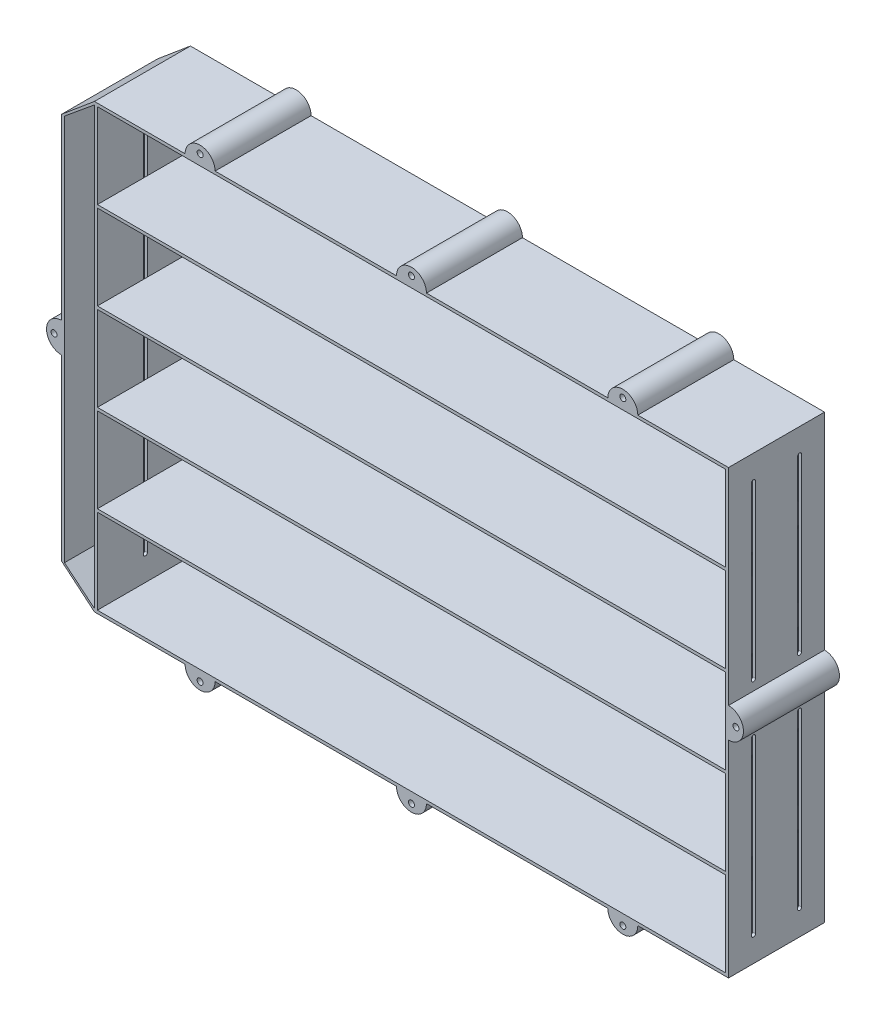
from build123d import *

# Parameters (mm, degrees)
SKETCH1_R           = 3
BOSS_EXTRUDE1_DEPTH = 96.2
SKETCH2_W           = 629.4
SKETCH2_H           = 85
CUT_EXTRUDE1_DEPTH  = 93.2
LPATTERN1_COUNT     = 5
LPATTERN1_PITCH     = 88
CUT_EXTRUDE3_DEPTH  = 93.2
CUT_EXTRUDE4_DEPTH  = 3
CUT_EXTRUDE5_DEPTH  = 3
CUT_EXTRUDE6_DEPTH  = 3


with BuildPart() as part:
    # Sketch1 → Boss-Extrude1 (new body)
    with BuildSketch(Plane.XY):
        with BuildLine():
            Line((0, 0), (0, 206.5))
            ThreePointArc((0, 206.5), (15, 221.5), (0, 236.5))
            Line((0, 236.5), (0, 443))
            Line((0, 443), (-90.9, 443))
            ThreePointArc((-90.9, 443), (-105.9, 458), (-120.9, 443))
            Line((-120.9, 443), (-302.7, 443))
            ThreePointArc((-302.7, 443), (-317.7, 458), (-332.7, 443))
            Line((-332.7, 443), (-514.5, 443))
            ThreePointArc((-514.5, 443), (-529.5, 458), (-544.5, 443))
            Line((-544.5, 443), (-635.4, 443))
            Line((-635.4, 443), (-668.4, 415.309712171))
            Line((-668.4, 415.309712171), (-668.4, 236.5))
            ThreePointArc((-668.4, 236.5), (-683.4, 221.5), (-668.4, 206.5))
            Line((-668.4, 206.5), (-668.4, 27.690287829))
            Line((-668.4, 27.690287829), (-635.4, 0))
            Line((-635.4, 0), (-544.5, 0))
            ThreePointArc((-544.5, 0), (-529.5, -15), (-514.5, 0))
            Line((-514.5, 0), (-332.7, 0))
            ThreePointArc((-332.7, 0), (-317.7, -15), (-302.7, 0))
            Line((-302.7, 0), (-120.9, 0))
            ThreePointArc((-120.9, 0), (-105.9, -15), (-90.9, 0))
            Line((-90.9, 0), (0, 0))
        make_face()
        with Locations(Location((-529.5, 450.5, 0), (0, 0, 180))):
            Circle(SKETCH1_R, mode=Mode.SUBTRACT)
        with Locations(Location((-317.7, 450.5, 0), (0, 0, 180))):
            Circle(SKETCH1_R, mode=Mode.SUBTRACT)
        with Locations(Location((-105.9, 450.5, 0), (0, 0, 180))):
            Circle(SKETCH1_R, mode=Mode.SUBTRACT)
        with Locations(Location((7.5, 221.5, 0), (0, 0, 180))):
            Circle(SKETCH1_R, mode=Mode.SUBTRACT)
        with Locations(Location((-675.9, 221.5, 0), (0, 0, 180))):
            Circle(SKETCH1_R, mode=Mode.SUBTRACT)
        with Locations(Location((-529.5, -7.5, 0), (0, 0, 180))):
            Circle(SKETCH1_R, mode=Mode.SUBTRACT)
        with Locations(Location((-317.7, -7.5, 0), (0, 0, 180))):
            Circle(SKETCH1_R, mode=Mode.SUBTRACT)
        with Locations(Location((-105.9, -7.5, 0), (0, 0, 180))):
            Circle(SKETCH1_R, mode=Mode.SUBTRACT)
    extrude(amount=BOSS_EXTRUDE1_DEPTH)

    # Sketch2 → Cut-Extrude1 (cut)
    with BuildSketch(Plane.XY.offset(96.2)):
        with Locations((-317.7, 397.5)):
            Rectangle(SKETCH2_W, SKETCH2_H)
    cut_extrude1 = extrude(amount=-CUT_EXTRUDE1_DEPTH, mode=Mode.SUBTRACT)

    # LPattern1: Cut-Extrude1 ×5
    with Locations(*[(0, -i * LPATTERN1_PITCH, 0) for i in range(1, LPATTERN1_COUNT)]):
        add(cut_extrude1, mode=Mode.SUBTRACT)

    # Sketch5 → Cut-Extrude3 (cut)
    with BuildSketch(Plane.XY.offset(96.2)):
        Polygon((-665.4, 415.309712171), (-665.4, 27.690287829), (-635.4, 3), (-635.4, 440), align=None)
    extrude(amount=-CUT_EXTRUDE3_DEPTH, mode=Mode.SUBTRACT)

    # Sketch7 → Cut-Extrude4 (cut)
    with BuildSketch(Plane(origin=(0, 0, 0), x_dir=(0, 0, -1), z_dir=(1, 0, 0))):
        with BuildLine():
            Line((-69.2, 418), (-69.2, 246.5))
            ThreePointArc((-69.2, 246.5), (-71.2, 244.5), (-73.2, 246.5))
            Line((-73.2, 246.5), (-73.2, 418))
            ThreePointArc((-73.2, 418), (-71.2, 420), (-69.2, 418))
        make_face()
        with BuildLine():
            Line((-23, 418), (-23, 246.5))
            ThreePointArc((-23, 246.5), (-25, 244.5), (-27, 246.5))
            Line((-27, 246.5), (-27, 418))
            ThreePointArc((-27, 418), (-25, 420), (-23, 418))
        make_face()
        with BuildLine():
            Line((-69.2, 196.5), (-69.2, 25))
            ThreePointArc((-69.2, 25), (-71.2, 23), (-73.2, 25))
            Line((-73.2, 25), (-73.2, 196.5))
            ThreePointArc((-73.2, 196.5), (-71.2, 198.5), (-69.2, 196.5))
        make_face()
        with BuildLine():
            Line((-23, 196.5), (-23, 25))
            ThreePointArc((-23, 25), (-25, 23), (-27, 25))
            Line((-27, 25), (-27, 196.5))
            ThreePointArc((-27, 196.5), (-25, 198.5), (-23, 196.5))
        make_face()
    extrude(amount=-CUT_EXTRUDE4_DEPTH, mode=Mode.SUBTRACT)

    # Sketch8 → Cut-Extrude5 (cut)
    with BuildSketch(Plane.ZY.offset(635.4)):
        with BuildLine():
            Line((50.1, 415), (50.1, 28))
            ThreePointArc((50.1, 28), (48.1, 26), (46.1, 28))
            Line((46.1, 28), (46.1, 415))
            ThreePointArc((46.1, 415), (48.1, 417), (50.1, 415))
        make_face()
    extrude(amount=-CUT_EXTRUDE5_DEPTH, mode=Mode.SUBTRACT)

    # Sketch9 → Cut-Extrude6 (cut)
    with BuildSketch(Plane.ZY.offset(668.4)):
        with BuildLine():
            Line((50.1, 390.309712171), (50.1, 52.690287829))
            ThreePointArc((50.1, 52.690287829), (48.1, 50.690287829), (46.1, 52.690287829))
            Line((46.1, 52.690287829), (46.1, 390.309712171))
            ThreePointArc((46.1, 390.309712171), (48.1, 392.309712171), (50.1, 390.309712171))
        make_face()
    extrude(amount=-CUT_EXTRUDE6_DEPTH, mode=Mode.SUBTRACT)


solid = part.part
